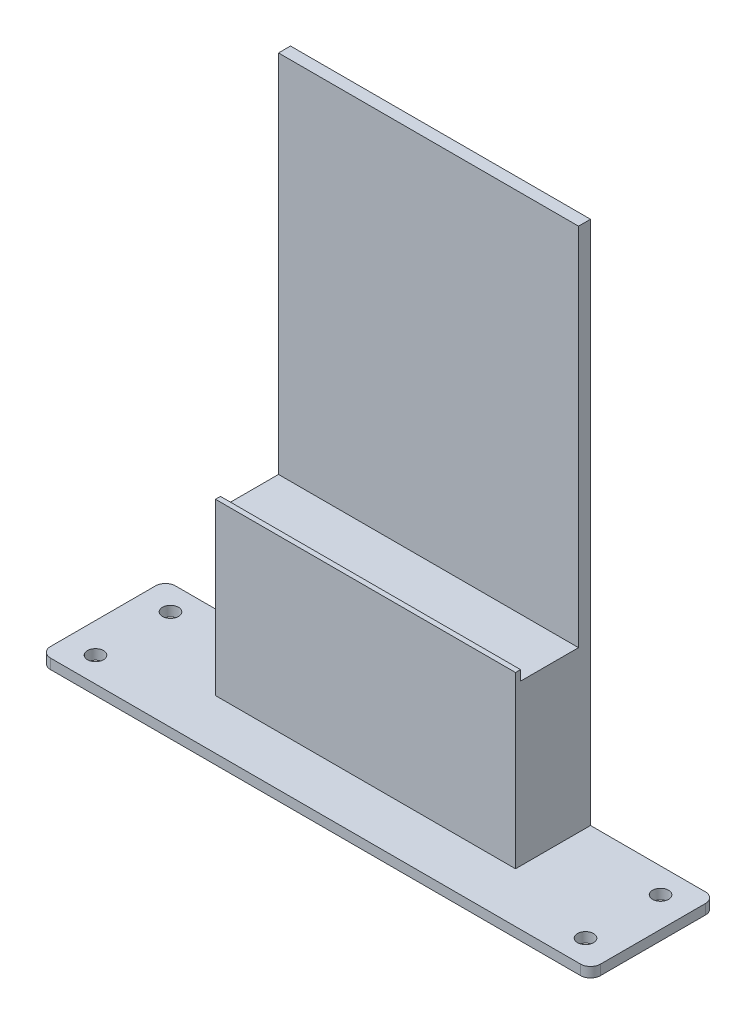
from build123d import *

# Parameters (mm, degrees)
SKETCH_1_W          = 110
SKETCH_1_H          = 25
SKETCH_1_R          = 1.6
EXTRUDE_1_DEPTH     = 2
SKETCH_2_W          = 60
SKETCH_2_H          = 15
EXTRUDE_2_DEPTH     = 113
CUT_EXTRUDE_1_DEPTH = 60
FILLET_1_R          = 2
FILLET_2_R          = 2
FILLET_3_R          = 2
FILLET_4_R          = 2
CUT_EXTRUDE_3_DEPTH = 144.5487722
SKETCH_8_W          = 60
SKETCH_8_H          = 6
CUT_EXTRUDE_4_DEPTH = 128.690093586


with BuildPart() as part:
    # 草图1 → 凸台-拉伸1 (new body)
    with BuildSketch(Plane(origin=(0, 0, 0), x_dir=(1, 0, 0), z_dir=(0, 1, 0))):
        Rectangle(SKETCH_1_W, SKETCH_1_H)
        with Locations(Location((-49, 7.5, 0), (0, 0, 270))):
            Circle(SKETCH_1_R, mode=Mode.SUBTRACT)
        with Locations(Location((49, 7.5, 0), (0, 0, 90))):
            Circle(SKETCH_1_R, mode=Mode.SUBTRACT)
        with Locations(Location((49, -7.5, 0), (0, 0, 270))):
            Circle(SKETCH_1_R, mode=Mode.SUBTRACT)
        with Locations(Location((-49, -7.5, 0), (0, 0, 90))):
            Circle(SKETCH_1_R, mode=Mode.SUBTRACT)
    extrude(amount=EXTRUDE_1_DEPTH)

    # 草图2 → 凸台-拉伸2 (add)
    with BuildSketch(Plane(origin=(0, 115, 0), x_dir=(1, 0, 0), z_dir=(0, 1, 0))):
        with Locations((0, 5)):
            Rectangle(SKETCH_2_W, SKETCH_2_H)
    extrude(amount=-EXTRUDE_2_DEPTH)

    # 草图3 → 切除-拉伸1 (cut)
    with BuildSketch(Plane(origin=(30, 0, 0), x_dir=(0, 0, -1), z_dir=(1, 0, 0))):
        Polygon((-2.5, 36), (-1.5, 36), (-1.5, 34), (10.1, 34), (10.1, 113), (-1.5, 113), (-1.5, 111), (-2.5, 111), align=None)
    extrude(amount=-CUT_EXTRUDE_1_DEPTH, mode=Mode.SUBTRACT)

    # 圆角1
    fillet_1_edges = [part.edges().sort_by_distance(p)[0] for p in [
        (55, 1, 12.5),
    ]]
    fillet(fillet_1_edges, radius=FILLET_1_R)

    # 圆角2
    fillet_2_edges = [part.edges().sort_by_distance(p)[0] for p in [
        (55, 1, -12.5),
    ]]
    fillet(fillet_2_edges, radius=FILLET_2_R)

    # 圆角3
    fillet_3_edges = [part.edges().sort_by_distance(p)[0] for p in [
        (-55, 1, -12.5),
    ]]
    fillet(fillet_3_edges, radius=FILLET_3_R)

    # 圆角4
    fillet_4_edges = [part.edges().sort_by_distance(p)[0] for p in [
        (-55, 1, 12.5),
    ]]
    fillet(fillet_4_edges, radius=FILLET_4_R)

    # 草图7 → 切除-拉伸3 (cut, through all)
    with BuildSketch(Plane(origin=(30, 0, 0), x_dir=(0, 0, -1), z_dir=(1, 0, 0))):
        Polygon((10.125373214, 107), (10.1, 113), (-1.5, 113), (-1.5, 110), (-2.572411073, 110), (-2.572411073, 115), (12.5, 115), (12.5, 107), align=None)
    extrude(amount=-CUT_EXTRUDE_3_DEPTH, mode=Mode.SUBTRACT)

    # 草图8 → 切除-拉伸4 (cut, through all)
    with BuildSketch(Plane.XY.offset(-10.1)):
        with Locations((0, 110)):
            Rectangle(SKETCH_8_W, SKETCH_8_H)
    extrude(amount=-CUT_EXTRUDE_4_DEPTH, mode=Mode.SUBTRACT)


solid = part.part
